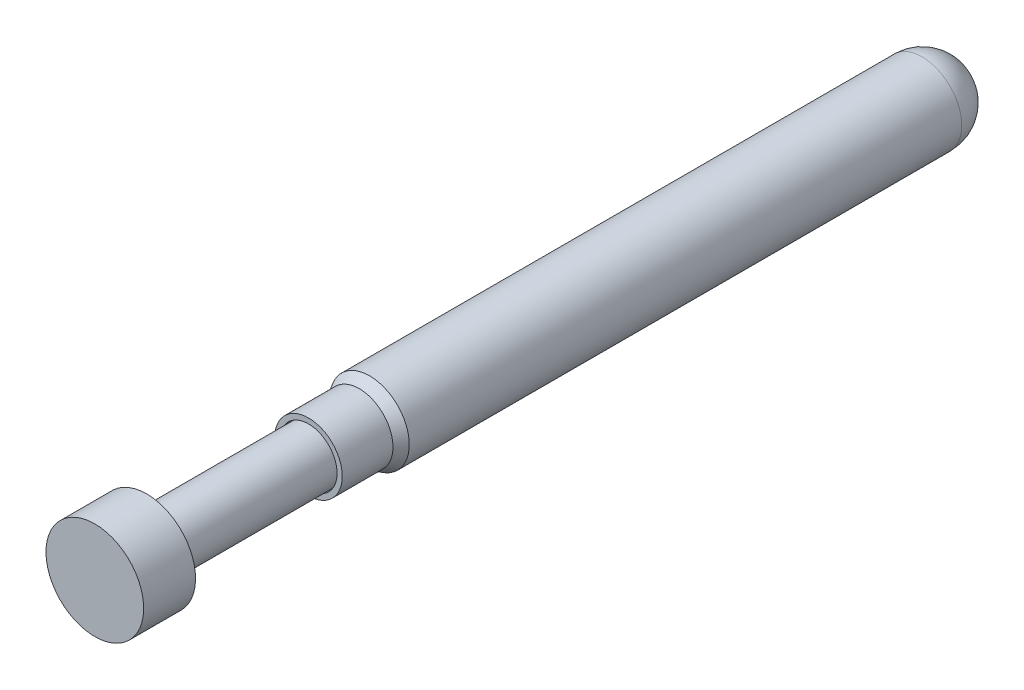
from build123d import *

# Parameters (mm, degrees)
SKETCH4_R          = 1.18872
CUT_EXTRUDE1_DEPTH = 13.335


with BuildPart() as part:
    # Sketch2 → Revolve1 (revolve)
    with BuildSketch(Plane(origin=(0, 0, 0), x_dir=(0, 0, -1), z_dir=(1, 0, 0))):
        with BuildLine():
            Line((-6.604, 1.651), (16.383, 1.651))
            ThreePointArc((16.383, 1.651), (17.550433296, 1.167433296), (18.034, 0))
            Line((18.034, 0), (-9.144, 0))
            Line((-9.144, 0), (-9.144, 1.40335))
            Line((-9.144, 1.40335), (-7.032942382, 1.40335))
            Line((-7.032942382, 1.40335), (-6.604, 1.651))
        make_face()
    revolve(axis=Axis((0, 0, -18.034), (0, 0, 1)))

    # Sketch4 → Cut-Extrude1 (cut)
    with BuildSketch(Plane.XY.offset(9.144)):
        Circle(SKETCH4_R)
    extrude(amount=-CUT_EXTRUDE1_DEPTH, mode=Mode.SUBTRACT)


with BuildPart() as body_2:
    # Sketch3 → Revolve2 (revolve)
    with BuildSketch(Plane(origin=(0, 0, 0), x_dir=(0, 0, -1), z_dir=(1, 0, 0))):
        Polygon((-18.034, 2.032), (-18.034, 0), (-2.794, 0), (-2.794, 1.1557), (-15.494, 1.1557), (-15.875, 2.032), align=None)
    revolve(axis=Axis((0, 0, 0), (0, 0, 1)))


solid = Compound([part.part, body_2.part])
